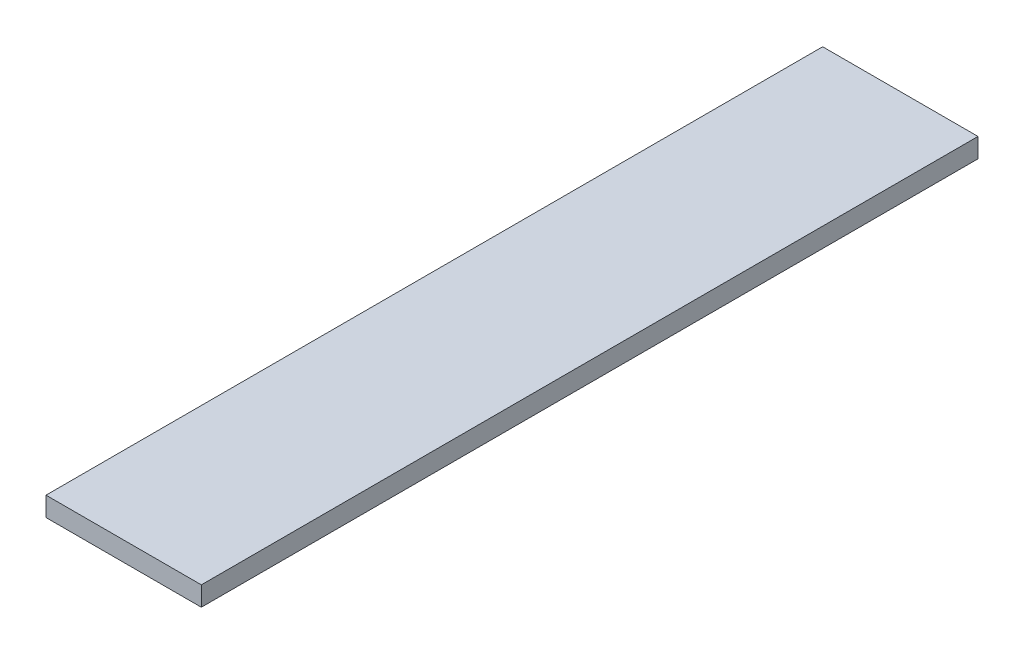
from build123d import *

# Parameters (mm, degrees)
SKETCH1_W           = 25.4
SKETCH1_H           = 127
BOSS_EXTRUDE1_DEPTH = 3.175


with BuildPart() as part:
    # Sketch1 → Boss-Extrude1 (new body)
    with BuildSketch(Plane(origin=(0, 0, 0), x_dir=(1, 0, 0), z_dir=(0, 1, 0))):
        with Locations((12.7, 63.5)):
            Rectangle(SKETCH1_W, SKETCH1_H)
    extrude(amount=BOSS_EXTRUDE1_DEPTH)


solid = part.part
